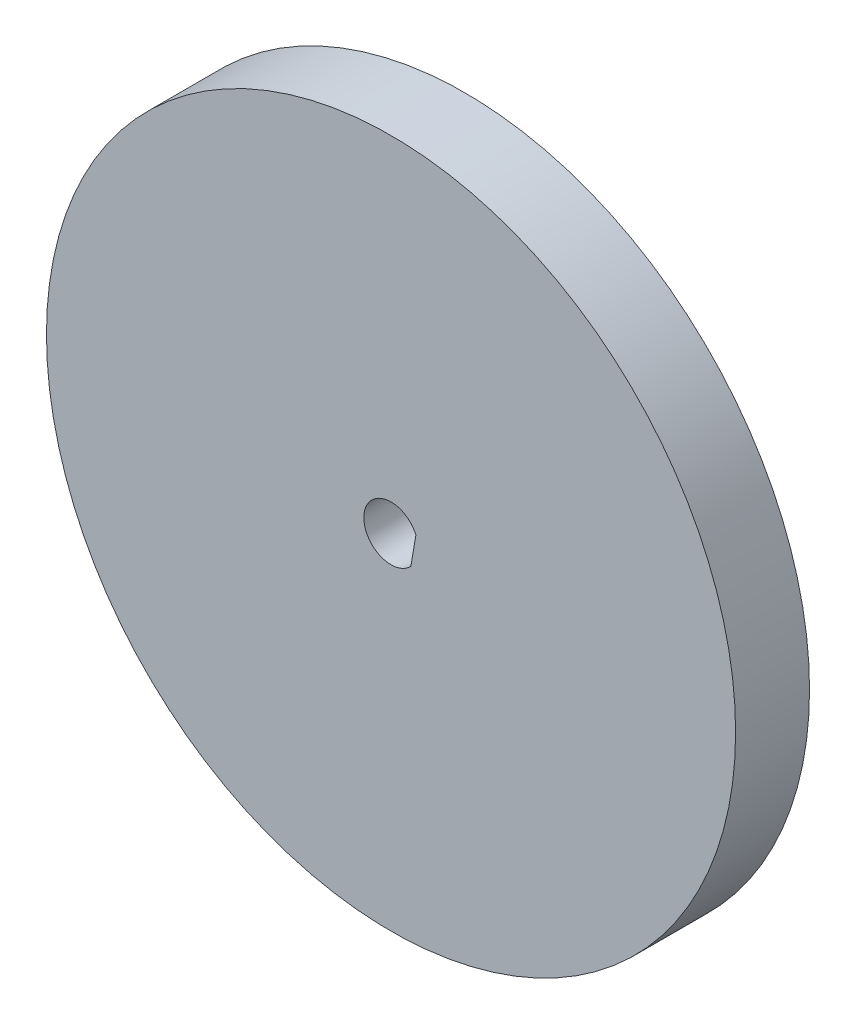
from build123d import *

# Parameters (mm, degrees)
SKETCH1_R           = 38
BOSS_EXTRUDE1_DEPTH = 8.1534
CUT_EXTRUDE1_DEPTH  = 70.625774322


with BuildPart() as part:
    # Sketch1 → Boss-Extrude1 (new body)
    with BuildSketch(Plane.XY):
        with Locations((-10.991688671, 10.796362155)):
            Circle(SKETCH1_R)
    extrude(amount=BOSS_EXTRUDE1_DEPTH)

    # Sketch3 → Cut-Extrude1 (cut, through all)
    with BuildSketch(Plane.XY.offset(8.1534)):
        with BuildLine():
            Line((-8.526986497, 10.377741567), (-8.249305013, 12.012640033))
            ThreePointArc((-8.249305013, 12.012640033), (-13.949331278, 11.298706861), (-8.804667981, 8.742843101))
            Line((-8.804667981, 8.742843101), (-8.526986497, 10.377741567))
        make_face()
    extrude(amount=-CUT_EXTRUDE1_DEPTH, mode=Mode.SUBTRACT)


solid = part.part
